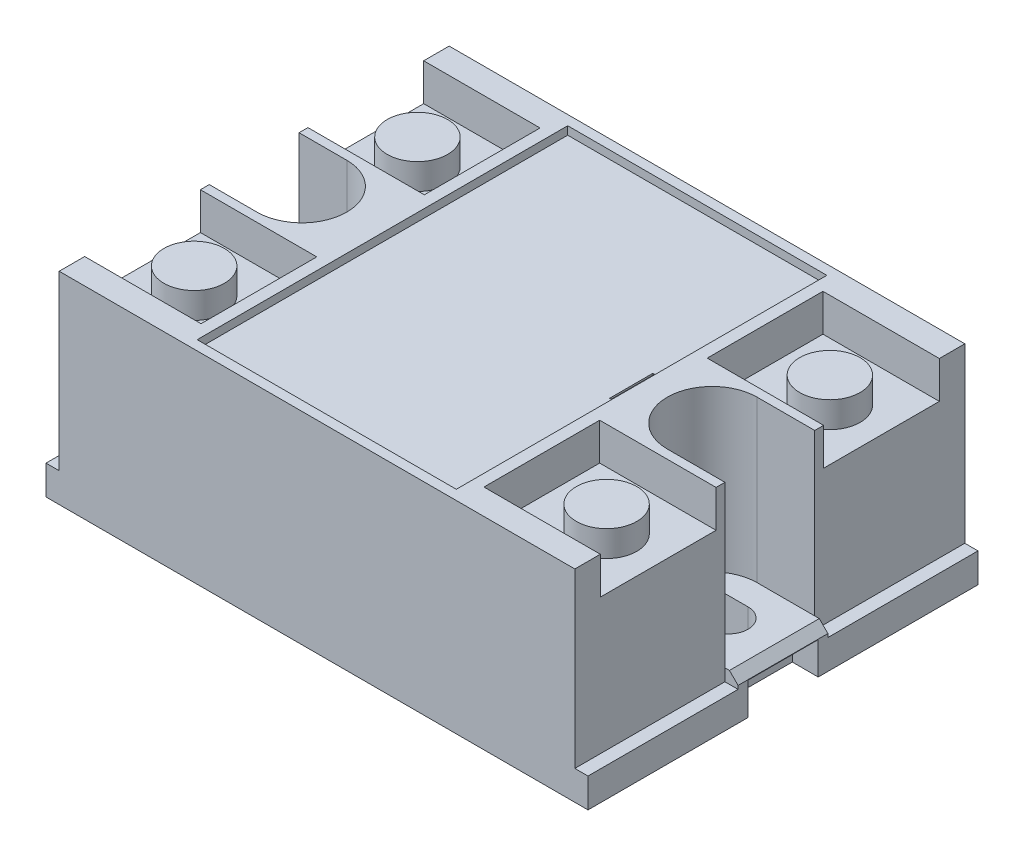
from build123d import *

# Parameters (mm, degrees)
SKETCH1_W                    = 62.75
SKETCH1_H                    = 45.15
BOSS_EXTRUDE1_DEPTH          = 23.4
SKETCH2_W                    = 30
SKETCH2_H                    = 42.9
CUT_EXTRUDE1_DEPTH           = 0.95
SKETCH3_W                    = 15
SKETCH3_H                    = 13.4
CUT_EXTRUDE2_DEPTH           = 4.3
SKETCH4_R                    = 3.5
BOSS_EXTRUDE2_DEPTH          = 3
CUT_EXTRUDE3_DEPTH           = 18.6
CUT_EXTRUDE_THIN1_DEPTH      = 45.699258942
CUT_EXTRUDE_THIN1_DEPTH_BACK = 1
SKETCH6_W                    = 0.2
SKETCH6_H                    = 5
CUT_EXTRUDE4_DEPTH           = 43.895002623
SKETCH8_R                    = 2.25
CUT_EXTRUDE5_DEPTH           = 43.895002623
SKETCH9_W                    = 1.525
SKETCH9_H                    = 45.15
CUT_EXTRUDE6_DEPTH           = 20
SKETCH11_W                   = 1.525
SKETCH11_H                   = 10.4
BOSS_EXTRUDE3_DEPTH          = 1.4
CHAMFER1_SIZE                = 1
SKETCH10_W                   = 3
SKETCH10_H                   = 8.15
CUT_EXTRUDE7_DEPTH           = 3.75


with BuildPart() as part:
    # Sketch1 → Boss-Extrude1 (new body)
    with BuildSketch(Plane(origin=(0, 0, 0), x_dir=(1, 0, 0), z_dir=(0, 1, 0))):
        Rectangle(SKETCH1_W, SKETCH1_H)
    extrude(amount=BOSS_EXTRUDE1_DEPTH)

    # Sketch2 → Cut-Extrude1 (cut)
    with BuildSketch(Plane(origin=(0, 23.4, 0), x_dir=(1, 0, 0), z_dir=(0, 1, 0))):
        Rectangle(SKETCH2_W, SKETCH2_H)
    extrude(amount=-CUT_EXTRUDE1_DEPTH, mode=Mode.SUBTRACT)

    # Sketch3 → Cut-Extrude2 (cut)
    with BuildSketch(Plane(origin=(0, 23.4, 0), x_dir=(1, 0, 0), z_dir=(0, 1, 0))):
        with Locations((-23.875, 12.925)):
            Rectangle(SKETCH3_W, SKETCH3_H)
        with Locations((-23.875, -12.925)):
            Rectangle(SKETCH3_W, SKETCH3_H)
        with Locations((23.875, -12.925)):
            Rectangle(SKETCH3_W, SKETCH3_H)
        with Locations((23.875, 12.925)):
            Rectangle(SKETCH3_W, SKETCH3_H)
    extrude(amount=-CUT_EXTRUDE2_DEPTH, mode=Mode.SUBTRACT)

    # Sketch4 → Boss-Extrude2 (add)
    with BuildSketch(Plane(origin=(0, 19.1, 0), x_dir=(1, 0, 0), z_dir=(0, 1, 0))):
        with Locations(Location((-23.875, 12.925, 0), (0, 0, 270))):
            Circle(SKETCH4_R)
        with Locations(Location((-23.875, -12.925, 0), (0, 0, 90))):
            Circle(SKETCH4_R)
        with Locations(Location((23.875, -12.925, 0), (0, 0, 270))):
            Circle(SKETCH4_R)
        with Locations(Location((23.875, 12.925, 0), (0, 0, 90))):
            Circle(SKETCH4_R)
    extrude(amount=BOSS_EXTRUDE2_DEPTH)

    # Sketch5 → Cut-Extrude3 (cut)
    with BuildSketch(Plane(origin=(0, 23.4, 0), x_dir=(1, 0, 0), z_dir=(0, 1, 0))):
        with BuildLine():
            Line((31.375, -5.2), (23.175, -5.2))
            ThreePointArc((23.175, -5.2), (17.975, 0), (23.175, 5.2))
            Line((23.175, 5.2), (31.375, 5.2))
            ThreePointArc((31.375, 5.2), (36.575, 0), (31.375, -5.2))
        make_face()
        with BuildLine():
            Line((-31.375, 5.2), (-24.325, 5.2))
            ThreePointArc((-24.325, 5.2), (-19.125, 0), (-24.325, -5.2))
            Line((-24.325, -5.2), (-31.375, -5.2))
            ThreePointArc((-31.375, -5.2), (-36.575, 0), (-31.375, 5.2))
        make_face()
    extrude(amount=-CUT_EXTRUDE3_DEPTH, mode=Mode.SUBTRACT)

    # Sketch6 → Cut-Extrude-Thin1 (cut, two sides: drawn at the far end of the back side and taken through both)
    with BuildSketch(Plane(origin=(0, 22.45, 0), x_dir=(1, 0, 0), z_dir=(0, 1, 0)).offset(-CUT_EXTRUDE_THIN1_DEPTH_BACK)):
        with Locations((13.9, 0)):
            Rectangle(SKETCH6_W, SKETCH6_H)
    extrude(amount=CUT_EXTRUDE_THIN1_DEPTH + CUT_EXTRUDE_THIN1_DEPTH_BACK, mode=Mode.SUBTRACT)

    # Sketch7 → Cut-Extrude4 (cut, through all)
    with BuildSketch(Plane(origin=(0, 4.8, 0), x_dir=(1, 0, 0), z_dir=(0, 1, 0))):
        with BuildLine():
            Line((22.275, 2.25), (25.075, 2.25))
            ThreePointArc((25.075, 2.25), (27.325, 0), (25.075, -2.25))
            Line((25.075, -2.25), (22.275, -2.25))
            ThreePointArc((22.275, -2.25), (20.025, 0), (22.275, 2.25))
        make_face()
    extrude(amount=-CUT_EXTRUDE4_DEPTH, mode=Mode.SUBTRACT)

    # Sketch8 → Cut-Extrude5 (cut, through all)
    with BuildSketch(Plane(origin=(0, 4.8, 0), x_dir=(1, 0, 0), z_dir=(0, 1, 0))):
        with Locations(Location((-23.825, 0, 0), (0, 0, 270))):
            Circle(SKETCH8_R)
    extrude(amount=-CUT_EXTRUDE5_DEPTH, mode=Mode.SUBTRACT)

    # Sketch9 → Cut-Extrude6 (cut)
    with BuildSketch(Plane(origin=(0, 23.4, 0), x_dir=(1, 0, 0), z_dir=(0, 1, 0))):
        with Locations((-30.6125, 0)):
            Rectangle(SKETCH9_W, SKETCH9_H)
        with Locations((30.6125, 0)):
            Rectangle(SKETCH9_W, SKETCH9_H)
    extrude(amount=-CUT_EXTRUDE6_DEPTH, mode=Mode.SUBTRACT)

    # Sketch11 → Boss-Extrude3 (add)
    with BuildSketch(Plane(origin=(0, 3.4, 0), x_dir=(1, 0, 0), z_dir=(0, 1, 0))):
        with Locations((-30.6125, 0)):
            Rectangle(SKETCH11_W, SKETCH11_H)
        with Locations((30.6125, 0)):
            Rectangle(SKETCH11_W, SKETCH11_H)
    extrude(amount=BOSS_EXTRUDE3_DEPTH)

    # Chamfer1
    chamfer1_edges = [part.edges().sort_by_distance(p)[0] for p in [
        (-31.375, 4.8, 0),
        (31.375, 4.8, 0),
    ]]
    chamfer(chamfer1_edges, length=CHAMFER1_SIZE)

    # Sketch10 → Cut-Extrude7 (cut)
    with BuildSketch(Plane.XZ):
        with Locations((29.875, 0)):
            Rectangle(SKETCH10_W, SKETCH10_H)
        with Locations((-29.875, 0)):
            Rectangle(SKETCH10_W, SKETCH10_H)
    extrude(amount=-CUT_EXTRUDE7_DEPTH, mode=Mode.SUBTRACT)


solid = part.part
